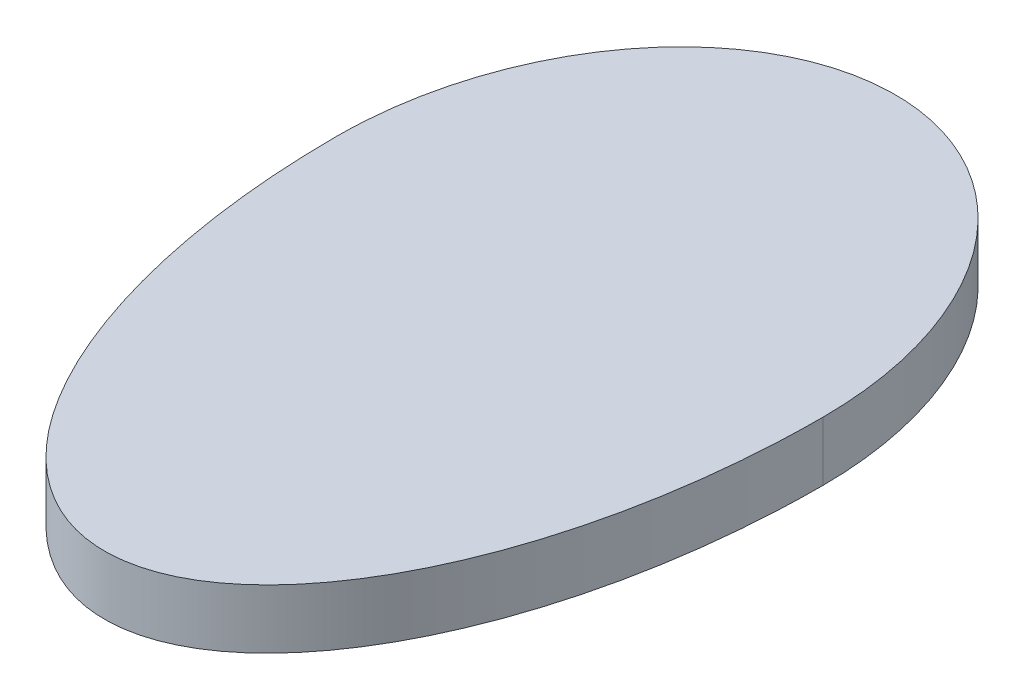
from build123d import *

# Parameters (mm, degrees)
BOSS_EXTRUDE1_DEPTH = 20


with BuildPart() as part:
    # Sketch4 → Boss-Extrude1 (new body)
    with BuildSketch(Plane(origin=(0, 0, 0), x_dir=(1, 0, 0), z_dir=(0, 1, 0))):
        with BuildLine():
            add(Edge.make_bspline(
                [(82.28, 0), (82.28, 106.76), (0, 106.76), (-82.28, 106.76), (-82.28, 0)],
                knots=[4.71238898, 4.71238898, 4.71238898, 6.283185307, 6.283185307, 7.853981634, 7.853981634, 7.853981634], degree=2, weights=[1, 0.707106781, 1, 0.707106781, 1]))
            add(Edge.make_bspline(
                [(-82.28, 0), (-82.28, -160.73), (0, -160.73), (82.28, -160.73), (82.28, 0)],
                knots=[4.71238898, 4.71238898, 4.71238898, 6.283185307, 6.283185307, 7.853981634, 7.853981634, 7.853981634], degree=2, weights=[1, 0.707106781, 1, 0.707106781, 1]))
        make_face()
    extrude(amount=BOSS_EXTRUDE1_DEPTH)


solid = part.part
